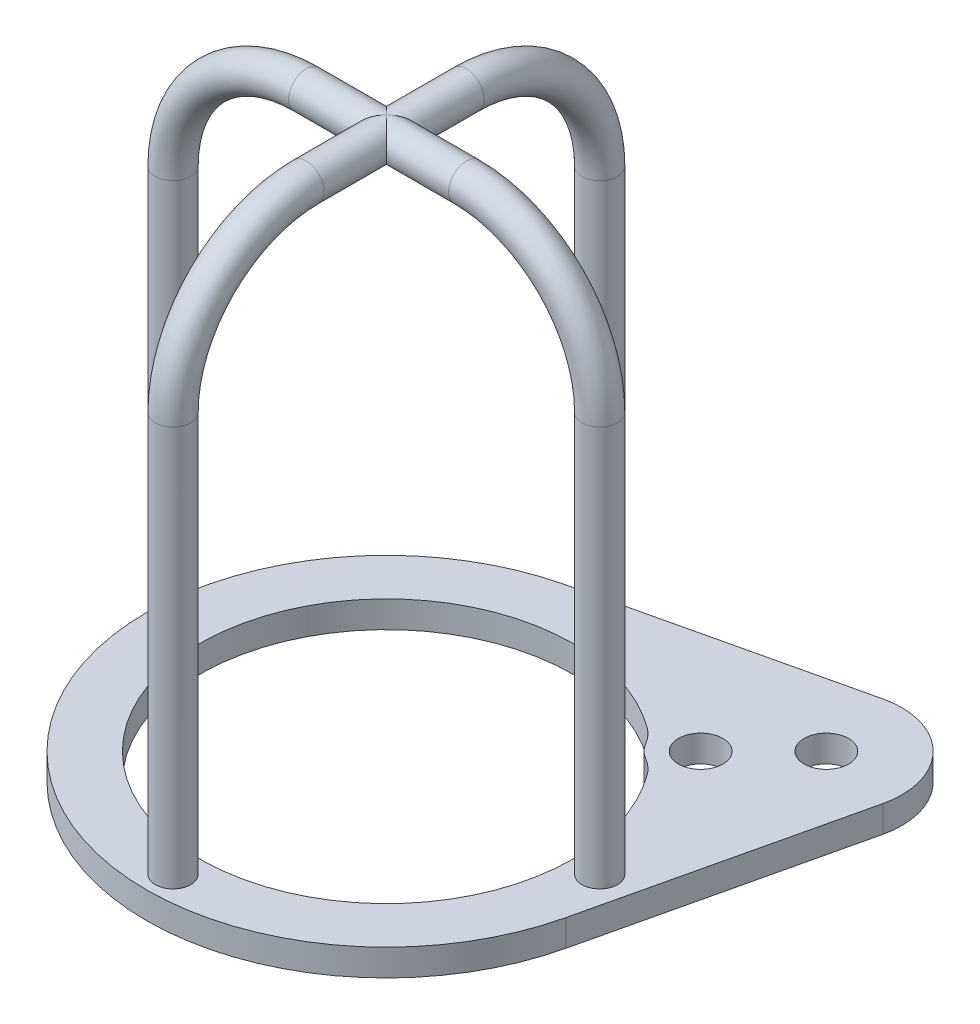
from build123d import *

# Parameters (mm, degrees)
ESQUISSE2_R                  = 2
R_P_TITION_CIRCULAIRE1_COUNT = 4
ESQUISSE4_R                  = 2.5
BOSS_EXTRU_1_DEPTH           = 3
CONG_1_R                     = 5


with BuildPart() as part:
    # Balayage1: sweep along a path in Esquisse1
    with BuildLine(Plane.XY) as balayage1_path:
        Line((0, 60), (9, 60))
        ThreePointArc((9, 60), (19.606601718, 55.606601718), (24, 45))
        Line((24, 45), (24, 0))
    # Esquisse2 → Balayage1 (sweep)
    with BuildSketch(Plane(origin=(0, 0, 0), x_dir=(1, 0, 0), z_dir=(0, 1, 0))):
        with Locations((24, 0)):
            Circle(ESQUISSE2_R)
    balayage1 = sweep(path=balayage1_path.line)

    # Répétition circulaire1: Balayage1 ×4 about axis
    r_p_tition_circulaire1_axis = Axis((0, 0, 0), (0, 1, 0))
    for i in range(1, R_P_TITION_CIRCULAIRE1_COUNT):
        add(balayage1.rotate(r_p_tition_circulaire1_axis, i * 360 / R_P_TITION_CIRCULAIRE1_COUNT))

    # Esquisse4 → Boss.-Extru.1 (add)
    with BuildSketch(Plane.XZ):
        with BuildLine():
            Line((26.298310212, 6.115462371), (33.027835001, -22.823499188))
            ThreePointArc((33.027835001, -22.823499188), (30.759144982, -30.759144982), (22.823499188, -33.027835001))
            Line((22.823499188, -33.027835001), (-6.115462371, -26.298310212))
            ThreePointArc((-6.115462371, -26.298310212), (-19.091883092, 19.091883092), (26.298310212, 6.115462371))
        make_face()
        with Locations((17.67766953, -17.67766953)):
            Circle(ESQUISSE4_R, mode=Mode.SUBTRACT)
        with Locations((24.748737342, -24.748737342)):
            Circle(ESQUISSE4_R, mode=Mode.SUBTRACT)
        with BuildLine():
            ThreePointArc((13.454452036, -16.123824621), (14.495689014, -14.495689014), (16.123824621, -13.454452036))
            ThreePointArc((16.123824621, -13.454452036), (-14.849242405, 14.849242405), (13.454452036, -16.123824621))
        make_face(mode=Mode.SUBTRACT)
    extrude(amount=BOSS_EXTRU_1_DEPTH)

    # Congé1
    cong_1_edges = [part.edges().sort_by_distance(p)[0] for p in [
        (13.454452036, -1.5, -16.123824621),
        (16.123824621, -1.5, -13.454452036),
    ]]
    fillet(cong_1_edges, radius=CONG_1_R)


solid = part.part
